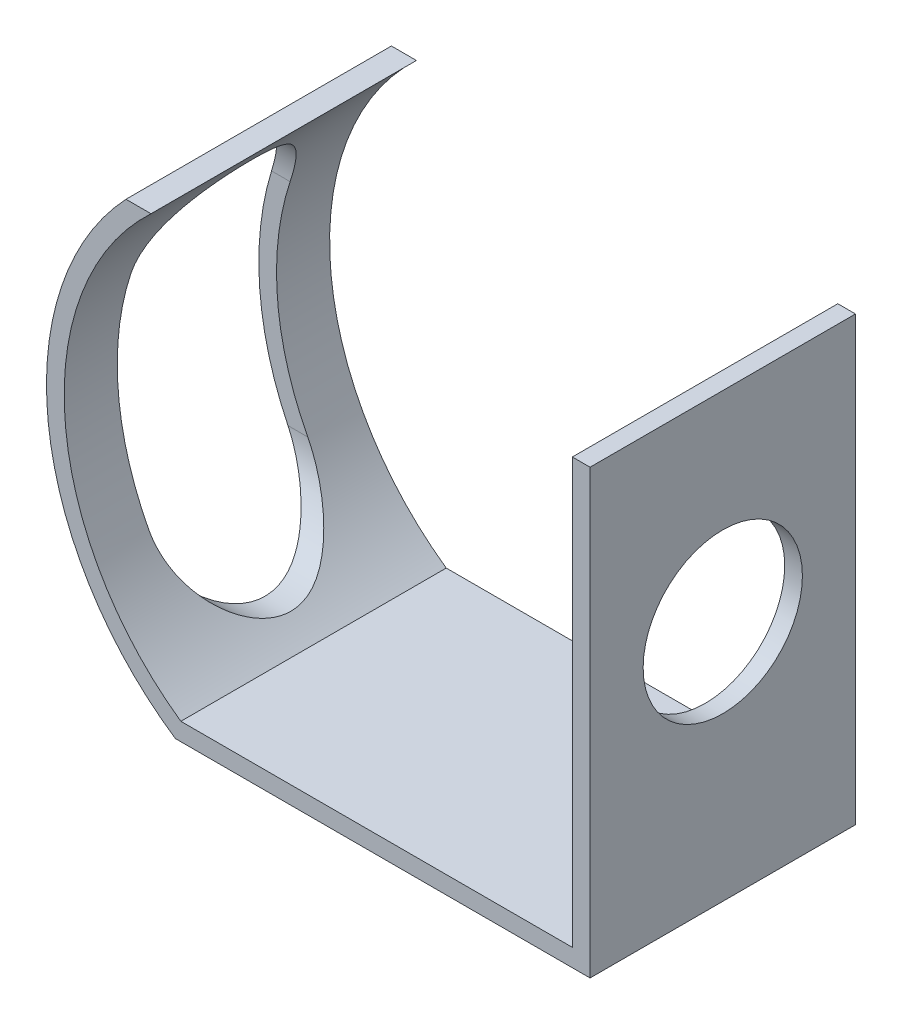
from build123d import *

# Parameters (mm, degrees)
SALIENTE_EXTRUIR1_DEPTH    = 75
CORTAR_EXTRUIR1_REACH      = 405.099
CROQUIS2_R                 = 45
CORTAR_EXTRUIR2_REACH      = 397.531
CORTAR_EXTRUIR2_END_RADIUS = 165


with BuildPart() as part:
    # Croquis1 → Saliente-Extruir1 (new, symmetric)
    with BuildSketch(Plane.XY):
        with BuildLine():
            Line((-10, 250), (0, 250))
            Line((0, 250), (0, 0))
            Line((0, 0), (-234.378862456, 0))
            ThreePointArc((-234.378862456, 0), (-306.168920604, 118.546607009), (-262.269991763, 250))
            Line((-262.269991763, 250), (-248.111243039, 250))
            ThreePointArc((-248.111243039, 250), (-296.806166022, 125.992691614), (-231.272178278, 10))
            Line((-231.272178278, 10), (-10, 10))
            Line((-10, 10), (-10, 250))
        make_face()
    extrude(amount=SALIENTE_EXTRUIR1_DEPTH, both=True)

    # Croquis2 → Cortar-Extruir1 (cut, up to next)
    with BuildSketch(Plane(origin=(0, 0, 0), x_dir=(0, 0, -1), z_dir=(1, 0, 0)), mode=Mode.PRIVATE) as cortar_extruir1_sk1:
        with Locations(Location((0, 136.841249694, 0), (0, 0, 90))):
            Circle(CROQUIS2_R)
    cortar_extruir1_tool1 = extrude(cortar_extruir1_sk1.sketch, amount=-CORTAR_EXTRUIR1_REACH, mode=Mode.PRIVATE) & part.part
    add(cortar_extruir1_tool1.solids().sort_by_distance((0, 136.84125, 0))[0], mode=Mode.SUBTRACT)

    # Cortar-Extruir2: up to this cylinder (the profile starts inside it)
    cortar_extruir2_end = Plane(origin=(-142.186281275, 136.841251, 0), z_dir=(0, 0, -1)) * Cylinder(CORTAR_EXTRUIR2_END_RADIUS, 1126.062, mode=Mode.PRIVATE)
    # Croquis3 → Cortar-Extruir2 (cut, up to the surface)
    with BuildSketch(Plane.ZY.offset(10), mode=Mode.PRIVATE) as cortar_extruir2_sk1:
        with BuildLine():
            Line((45, 185), (45, 65))
            ThreePointArc((45, 65), (0, 20), (-45, 65))
            Line((-45, 65), (-45, 185))
            ThreePointArc((-45, 185), (0, 230), (45, 185))
        make_face()
    cortar_extruir2_tool1 = extrude(cortar_extruir2_sk1.sketch, amount=CORTAR_EXTRUIR2_REACH, mode=Mode.PRIVATE) & cortar_extruir2_end
    add(cortar_extruir2_tool1.solids().sort_by_distance((-10, 125, 0))[0], mode=Mode.SUBTRACT)


solid = part.part
